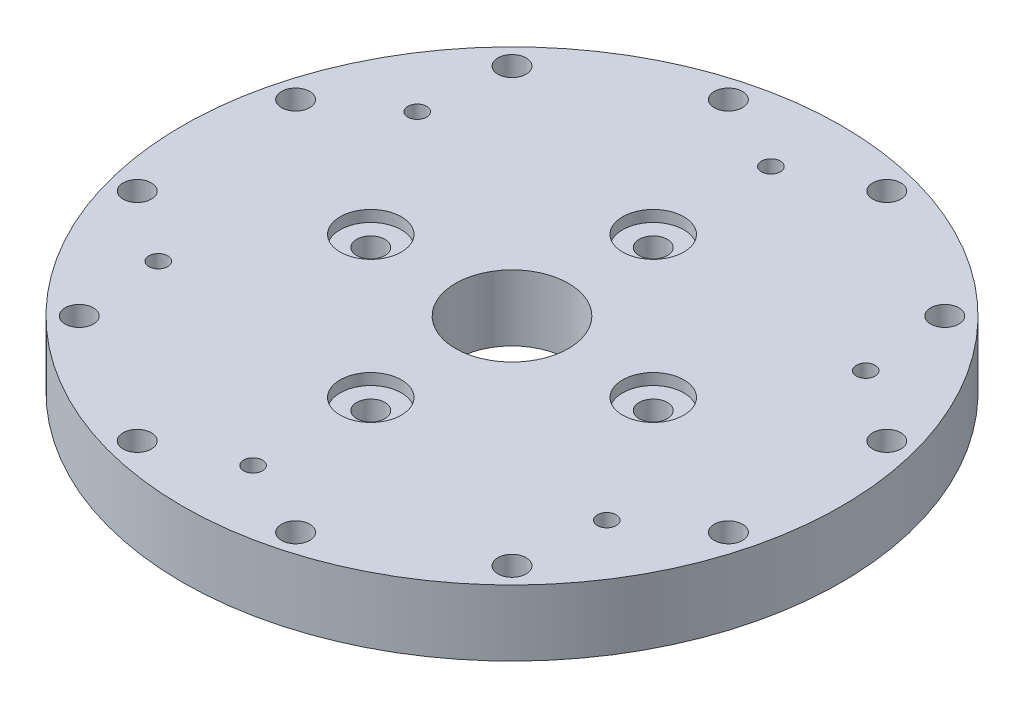
from build123d import *

# Parameters (mm, degrees)
SKETCH1_R           = 35
SKETCH1_R_2         = 6
SKETCH1_R_3         = 1.5
SKETCH1_R_4         = 1
BOSS_EXTRUDE1_DEPTH = 7
SKETCH2_R           = 3.25
CUT_EXTRUDE1_DEPTH  = 1.2


with BuildPart() as part:
    # Sketch1 → Boss-Extrude1 (new body)
    with BuildSketch(Plane(origin=(0, 0, 0), x_dir=(1, 0, 0), z_dir=(0, 1, 0))):
        with Locations(Location((0, 0, 0), (0, 0, 270))):
            Circle(SKETCH1_R)
        with Locations(Location((0, 0, 0), (0, 0, 270))):
            Circle(SKETCH1_R_2, mode=Mode.SUBTRACT)
        with Locations(Location((0, 15, 0), (0, 0, 270))):
            Circle(SKETCH1_R_3, mode=Mode.SUBTRACT)
        with Locations(Location((15, 0, 0), (0, 0, 270))):
            Circle(SKETCH1_R_3, mode=Mode.SUBTRACT)
        with Locations(Location((0, -15, 0), (0, 0, 270))):
            Circle(SKETCH1_R_3, mode=Mode.SUBTRACT)
        with Locations(Location((-15, 0, 0), (0, 0, 270))):
            Circle(SKETCH1_R_3, mode=Mode.SUBTRACT)
        with Locations(Location((-31.392589354, -8.411618966, 0), (0, 0, 270))):
            Circle(SKETCH1_R_3, mode=Mode.SUBTRACT)
        with Locations(Location((-31.392589354, 8.411618966, 0), (0, 0, 270))):
            Circle(SKETCH1_R_3, mode=Mode.SUBTRACT)
        with Locations(Location((-22.980970389, 22.980970389, 0), (0, 0, 270))):
            Circle(SKETCH1_R_3, mode=Mode.SUBTRACT)
        with Locations(Location((-8.411618966, 31.392589354, 0), (0, 0, 270))):
            Circle(SKETCH1_R_3, mode=Mode.SUBTRACT)
        with Locations(Location((8.411618966, 31.392589354, 0), (0, 0, 270))):
            Circle(SKETCH1_R_3, mode=Mode.SUBTRACT)
        with Locations(Location((22.980970389, 22.980970389, 0), (0, 0, 270))):
            Circle(SKETCH1_R_3, mode=Mode.SUBTRACT)
        with Locations(Location((31.392589354, 8.411618966, 0), (0, 0, 270))):
            Circle(SKETCH1_R_3, mode=Mode.SUBTRACT)
        with Locations(Location((31.392589354, -8.411618966, 0), (0, 0, 270))):
            Circle(SKETCH1_R_3, mode=Mode.SUBTRACT)
        with Locations(Location((22.980970389, -22.980970389, 0), (0, 0, 270))):
            Circle(SKETCH1_R_3, mode=Mode.SUBTRACT)
        with Locations(Location((8.411618966, -31.392589354, 0), (0, 0, 270))):
            Circle(SKETCH1_R_3, mode=Mode.SUBTRACT)
        with Locations(Location((-8.411618966, -31.392589354, 0), (0, 0, 270))):
            Circle(SKETCH1_R_3, mode=Mode.SUBTRACT)
        with Locations(Location((-22.980970389, -22.980970389, 0), (0, 0, 270))):
            Circle(SKETCH1_R_3, mode=Mode.SUBTRACT)
        with Locations(Location((0, 27.5, 0), (0, 0, 270))):
            Circle(SKETCH1_R_4, mode=Mode.SUBTRACT)
        with Locations(Location((23.815698604, 13.75, 0), (0, 0, 270))):
            Circle(SKETCH1_R_4, mode=Mode.SUBTRACT)
        with Locations(Location((23.815698604, -13.75, 0), (0, 0, 270))):
            Circle(SKETCH1_R_4, mode=Mode.SUBTRACT)
        with Locations(Location((0, -27.5, 0), (0, 0, 270))):
            Circle(SKETCH1_R_4, mode=Mode.SUBTRACT)
        with Locations(Location((-23.815698604, -13.75, 0), (0, 0, 270))):
            Circle(SKETCH1_R_4, mode=Mode.SUBTRACT)
        with Locations(Location((-23.815698604, 13.75, 0), (0, 0, 270))):
            Circle(SKETCH1_R_4, mode=Mode.SUBTRACT)
    extrude(amount=BOSS_EXTRUDE1_DEPTH)

    # Sketch2 → Cut-Extrude1 (cut)
    with BuildSketch(Plane(origin=(0, 7, 0), x_dir=(1, 0, 0), z_dir=(0, 1, 0))):
        with Locations(Location((0, 15, 0), (0, 0, 270))):
            Circle(SKETCH2_R)
        with Locations(Location((15, 0, 0), (0, 0, 270))):
            Circle(SKETCH2_R)
        with Locations(Location((0, -15, 0), (0, 0, 270))):
            Circle(SKETCH2_R)
        with Locations(Location((-15, 0, 0), (0, 0, 270))):
            Circle(SKETCH2_R)
    extrude(amount=-CUT_EXTRUDE1_DEPTH, mode=Mode.SUBTRACT)


solid = part.part
